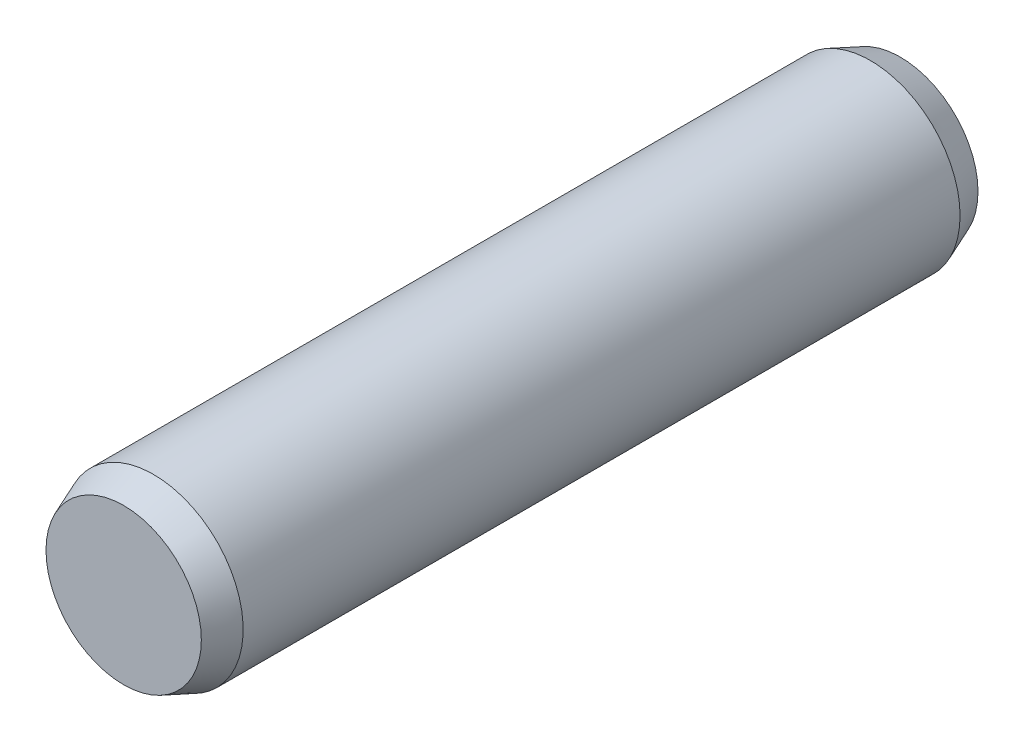
from build123d import *

# Parameters (mm, degrees)
SKETCH1_R           = 1.5
BOSS_EXTRUDE1_DEPTH = 6.5
CHAMFER1_SIZE       = 0.5
CHAMFER1_SIZE2      = 0.2
CHAMFER2_SIZE       = 0.2
CHAMFER2_SIZE2      = 0.5


with BuildPart() as part:
    # Sketch1 → Boss-Extrude1 (new, symmetric)
    with BuildSketch(Plane.XY):
        with Locations(Location((0, 0, 0), (0, 0, 180))):
            Circle(SKETCH1_R)
    extrude(amount=BOSS_EXTRUDE1_DEPTH, both=True)

    # Chamfer1
    chamfer1_edges = [part.edges().sort_by_distance(p)[0] for p in [
        (1.5, 0, 6.5),
    ]]
    chamfer1_side = [part.faces().sort_by_distance(p)[0] for p in [
        (1.5, 0, 0),
    ]]
    chamfer(chamfer1_edges, length=CHAMFER1_SIZE, length2=CHAMFER1_SIZE2, reference=chamfer1_side[0])

    # Chamfer2
    chamfer2_edges = [part.edges().sort_by_distance(p)[0] for p in [
        (1.5, 0, -6.5),
    ]]
    chamfer2_side = [part.faces().sort_by_distance(p)[0] for p in [
        (0, 0, -6.5),
    ]]
    chamfer(chamfer2_edges, length=CHAMFER2_SIZE, length2=CHAMFER2_SIZE2, reference=chamfer2_side[0])


solid = part.part
